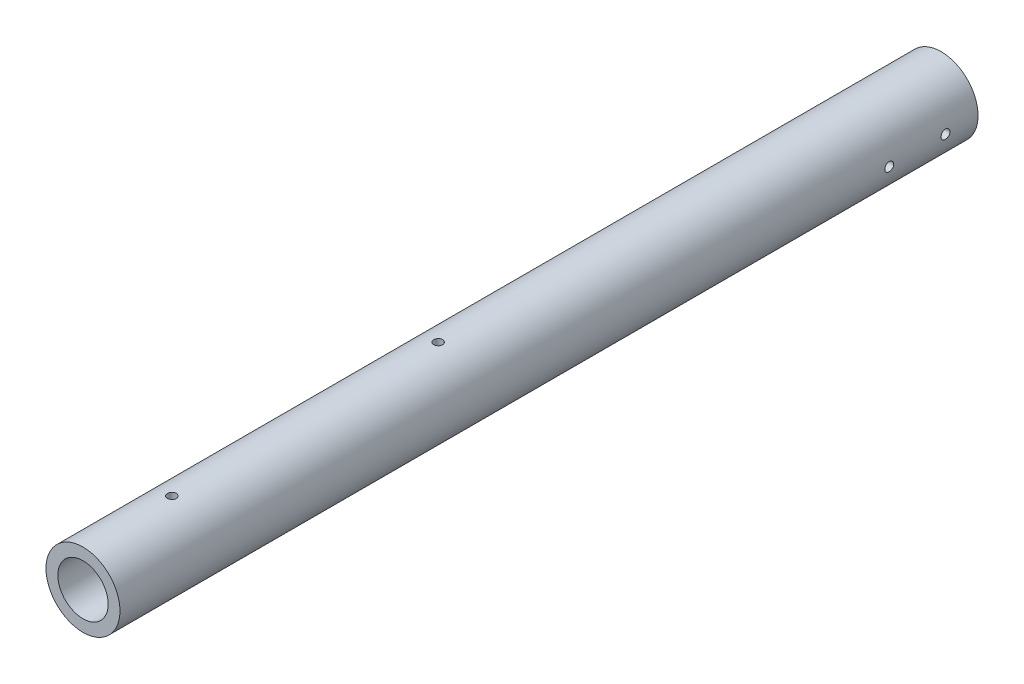
from build123d import *

# Parameters (mm, degrees)
SKETCH1_R               = 12.5
SKETCH1_R_2             = 8.5
BOSS_EXTRUDE1_DEPTH     = 400
CUT_EXTRUDE1_DEPTH      = 401.390434451
CUT_EXTRUDE1_DEPTH_BACK = 401.390434451
SKETCH2_R               = 1.5
CUT_EXTRUDE2_DEPTH      = 401.390434558
CUT_EXTRUDE2_DEPTH_BACK = 401.390434558
SKETCH3_R               = 1.5
CUT_EXTRUDE3_DEPTH      = 401.390434559
CUT_EXTRUDE3_DEPTH_BACK = 110
SKETCH4_R               = 16.409503563


with BuildPart() as part:
    # Sketch1 → Boss-Extrude1 (new body)
    with BuildSketch(Plane.XY):
        Circle(SKETCH1_R)
        Circle(SKETCH1_R_2, mode=Mode.SUBTRACT)
    extrude(amount=BOSS_EXTRUDE1_DEPTH)

    # Sketch2 → Cut-Extrude1 (cut, two sides: drawn at the far end of the back side and taken through both)
    with BuildSketch(Plane(origin=(0, 0, 0), x_dir=(1, 0, 0), z_dir=(0, 1, 0)).offset(-CUT_EXTRUDE1_DEPTH_BACK)):
        with Locations(Location((0, -370, 0), (0, 0, 270))):
            Circle(SKETCH2_R)
        with Locations(Location((0, -280, 0), (0, 0, 270))):
            Circle(SKETCH2_R)
    extrude(amount=CUT_EXTRUDE1_DEPTH + CUT_EXTRUDE1_DEPTH_BACK, mode=Mode.SUBTRACT)

    # Sketch3 → Cut-Extrude2 (cut, two sides: drawn at the far end of the back side and taken through both)
    with BuildSketch(Plane(origin=(0, 0, 0), x_dir=(0, 0, -1), z_dir=(1, 0, 0)).offset(-CUT_EXTRUDE2_DEPTH_BACK)):
        with Locations((-121, 0)):
            Circle(SKETCH3_R)
        with Locations((-140, 0)):
            Circle(SKETCH3_R)
    extrude(amount=CUT_EXTRUDE2_DEPTH + CUT_EXTRUDE2_DEPTH_BACK, mode=Mode.SUBTRACT)

    # Sketch4 → Cut-Extrude3 (cut, two sides: drawn at the far end of the back side and taken through both)
    with BuildSketch(Plane(origin=(0, 0, 0), x_dir=(-1, 0, 0), z_dir=(0, 0, -1)).offset(-CUT_EXTRUDE3_DEPTH_BACK)):
        Circle(SKETCH4_R)
    extrude(amount=CUT_EXTRUDE3_DEPTH + CUT_EXTRUDE3_DEPTH_BACK, mode=Mode.SUBTRACT)


solid = part.part
